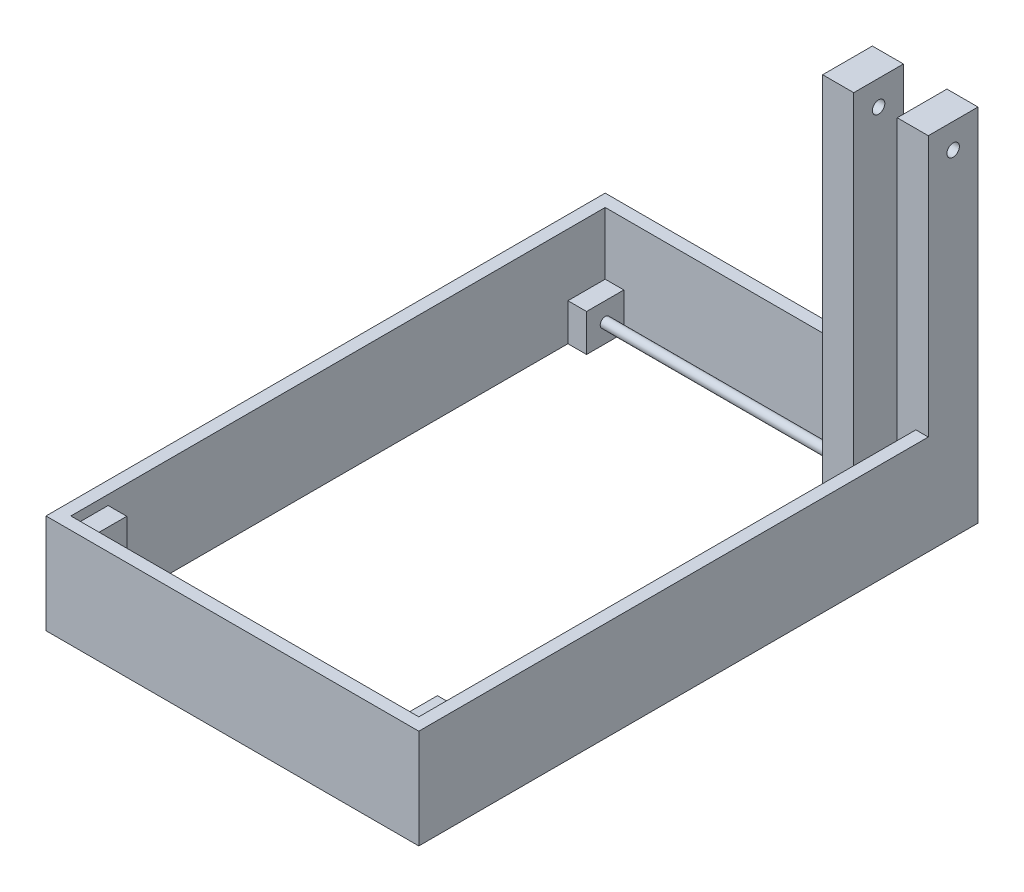
from build123d import *

# Parameters (mm, degrees)
SKETCH1_W                      = 300
SKETCH1_H                      = 450
BOSS_EXTRUDE1_DEPTH            = 80
SHELL1_T                       = -10
SKETCH2_W                      = 30
SKETCH2_H                      = 30
BOSS_EXTRUDE2_DEPTH            = 15
BOSS_EXTRUDE4_REACH            = 366.211
SKETCH3_R                      = 4
SKETCH4_R                      = 4
BOSS_EXTRUDE5_DEPTH            = 250
BOSS_EXTRUDE6_DEPTH            = 210
BOSS_EXTRUDE6_DEPTH_BACK       = 80
SKETCH5_W                      = 25
SKETCH5_H                      = 40
SKETCH6_W                      = 35
SKETCH6_H                      = 80
CUT_EXTRUDE1_DEPTH             = 300
BOSS_EXTRUDE7_START            = -80
SKETCH8_W                      = 25
SKETCH8_H                      = 40
BOSS_EXTRUDE7_DEPTH            = 290
CUT_EXTRUDE2_REACH             = 460.639
SKETCH10_R                     = 5
CUT_EXTRUDE2_DIRECTION_2_DEPTH = 300


with BuildPart() as part:
    # Sketch1 → Boss-Extrude1 (new body)
    with BuildSketch(Plane(origin=(0, 0, 0), x_dir=(1, 0, 0), z_dir=(0, 1, 0))):
        Rectangle(SKETCH1_W, SKETCH1_H)
    extrude(amount=BOSS_EXTRUDE1_DEPTH)

    # Shell1
    shell1_openings = [part.faces().sort_by_distance(p)[0] for p in [
        (0, 80, 0),
        (0, 0, 0),
    ]]
    offset(amount=SHELL1_T, openings=shell1_openings, kind=Kind.INTERSECTION)

    # Sketch2 → Boss-Extrude2 (add)
    with BuildSketch(Plane.ZY.offset(-140)):
        with Locations((-200, 15)):
            Rectangle(SKETCH2_W, SKETCH2_H)
        with Locations((200, 57.274341307)):
            Rectangle(SKETCH2_W, SKETCH2_H)
    boss_extrude2 = extrude(amount=BOSS_EXTRUDE2_DEPTH)

    # Mirror2: Boss-Extrude2 across plane
    add(boss_extrude2.mirror(Plane(origin=(0, 0, 0), x_dir=(0, 0, 1), z_dir=(1, 0, 0))))

    # Sketch3 → Boss-Extrude4 (add, up to next)
    with BuildSketch(Plane.ZY.offset(-125), mode=Mode.PRIVATE) as boss_extrude4_sk1:
        with Locations(Location((-200, 15, 0), (0, 0, 180))):
            Circle(SKETCH3_R)
    boss_extrude4_tool1 = extrude(boss_extrude4_sk1.sketch, amount=BOSS_EXTRUDE4_REACH, mode=Mode.PRIVATE) - part.part
    add(boss_extrude4_tool1.solids().sort_by_distance((125, 15, -200))[0])

    # Sketch4 → Boss-Extrude5 (add)
    with BuildSketch(Plane.ZY.offset(-125)):
        with Locations(Location((200, 57.274341307, 0), (0, 0, 180))):
            Circle(SKETCH4_R)
    extrude(amount=BOSS_EXTRUDE5_DEPTH)

    # Sketch5 → Boss-Extrude6 (add, two sides: drawn at the far end of the back side and taken through both)
    with BuildSketch(Plane(origin=(0, 80, 0), x_dir=(1, 0, 0), z_dir=(0, 1, 0)).offset(-BOSS_EXTRUDE6_DEPTH_BACK)):
        with Locations((137.5, 205)):
            Rectangle(SKETCH5_W, SKETCH5_H)
    extrude(amount=BOSS_EXTRUDE6_DEPTH + BOSS_EXTRUDE6_DEPTH_BACK)

    # Sketch6 → Cut-Extrude1 (cut)
    with BuildSketch(Plane.XY.offset(-215)):
        with Locations((107.5, 40)):
            Rectangle(SKETCH6_W, SKETCH6_H)
    extrude(amount=-CUT_EXTRUDE1_DEPTH, mode=Mode.SUBTRACT)

    # Sketch8 → Boss-Extrude7 (add)
    with BuildSketch(Plane(origin=(0, 80, 0), x_dir=(1, 0, 0), z_dir=(0, 1, 0)).offset(BOSS_EXTRUDE7_START)):
        with Locations((77.5, 205)):
            Rectangle(SKETCH8_W, SKETCH8_H)
    extrude(amount=BOSS_EXTRUDE7_DEPTH)

    # Cut-Extrude2: up to this face of the body (flat: up to its plane)
    cut_extrude2_end = Plane(part.part.faces().sort_by_distance((65, 153.422023127, -203.907073233))[0])
    # Sketch10 → Cut-Extrude2 (cut, up to the picked face)
    with BuildSketch(Plane.ZY.offset(-125), mode=Mode.PRIVATE) as cut_extrude2_sk1:
        with Locations((-205, 270)):
            Circle(SKETCH10_R)
    cut_extrude2_tool1 = split(extrude(cut_extrude2_sk1.sketch, amount=CUT_EXTRUDE2_REACH, mode=Mode.PRIVATE), bisect_by=cut_extrude2_end, keep=Keep.BOTH, mode=Mode.PRIVATE)
    add(cut_extrude2_tool1.solids().sort_by(Axis((125, 270, -205), (-1, 0, 0)))[0], mode=Mode.SUBTRACT)

    # Sketch10 → Cut-Extrude2 direction 2 (cut)
    with BuildSketch(Plane.ZY.offset(-125)):
        with Locations((-205, 270)):
            Circle(SKETCH10_R)
    extrude(amount=-CUT_EXTRUDE2_DIRECTION_2_DEPTH, mode=Mode.SUBTRACT)


solid = part.part
